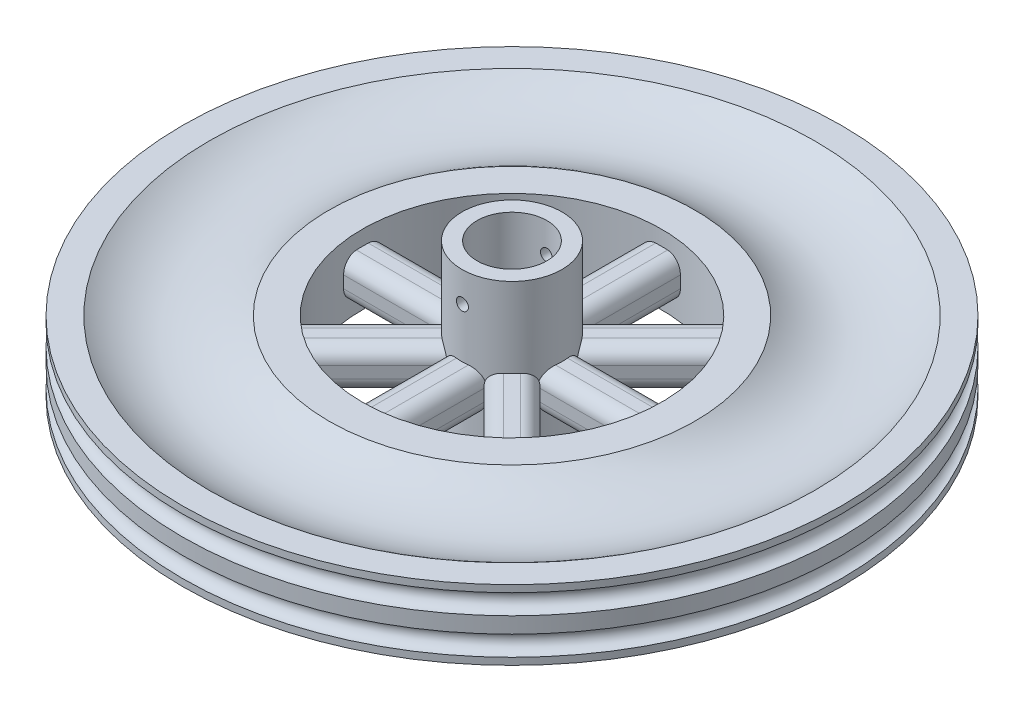
from build123d import *

# Parameters (mm, degrees)
SKETCH1_W                = 25
SKETCH1_H                = 100
BOSS_EXTRUDE1_REACH      = 240.642
BOSS_EXTRUDE1_END_RADIUS = 75
CIRPATTERN1_COUNT        = 8
SKETCH7_R                = 17.5
CUT_EXTRUDE1_DEPTH       = 92
SKETCH8_R                = 3
CUT_EXTRUDE2_DEPTH       = 25
FILLET1_R                = 2


with BuildPart() as part:
    # Sketch1 → Revolve1 (revolve)
    with BuildSketch(Plane.XY):
        with Locations((-12.5, 0)):
            Rectangle(SKETCH1_W, SKETCH1_H)
    revolve(axis=Axis((0, 170.759162304, 0), (0, -1, 0)))



with BuildPart() as body_2:
    # Sketch5 → Revolve2 (revolve)
    with BuildSketch(Plane.XY):
        with BuildLine():
            Line((-75, -17.5), (-75, 17.5))
            Line((-75, 17.5), (-91.608683351, 17.5))
            ThreePointArc((-91.608683351, 17.5), (-121.608683351, 7.5), (-151.608683351, 17.5))
            Line((-151.608683351, 17.5), (-165, 17.5))
            Line((-165, 17.5), (-165, 14))
            ThreePointArc((-165, 14), (-160, 9), (-165, 4))
            Line((-165, 4), (-165, -4))
            ThreePointArc((-165, -4), (-160, -9), (-165, -14))
            Line((-165, -14), (-165, -17.5))
            Line((-165, -17.5), (-151.608683351, -17.5))
            ThreePointArc((-151.608683351, -17.5), (-121.608683351, -7.5), (-91.608683351, -17.5))
            Line((-91.608683351, -17.5), (-75, -17.5))
        make_face()
    revolve(axis=Axis((0, 93.518433628, 0), (0, -1, 0)))


with BuildPart() as part_1:
    add(part.part)

    add(body_2.part)  # Boss-Extrude1 merges body 2
    # Boss-Extrude1: up to this cylinder (the profile starts inside it)
    boss_extrude1_end = Plane(origin=(0, 0, 0), z_dir=(0, 1, 0)) * Cylinder(BOSS_EXTRUDE1_END_RADIUS, 632.284, mode=Mode.PRIVATE)
    # Sketch6 → Boss-Extrude1 (add, up to the surface)
    with BuildSketch(Plane(origin=(0, 0, 0), x_dir=(0, 0, -1), z_dir=(1, 0, 0)), mode=Mode.PRIVATE) as boss_extrude1_sk1:
        with BuildLine():
            Line((3, 10), (-3, 10))
            ThreePointArc((-3, 10), (-7.949747468, 7.949747468), (-10, 3))
            Line((-10, 3), (-10, -3))
            ThreePointArc((-10, -3), (-7.949747468, -7.949747468), (-3, -10))
            Line((-3, -10), (3, -10))
            ThreePointArc((3, -10), (7.949747468, -7.949747468), (10, -3))
            Line((10, -3), (10, 3))
            ThreePointArc((10, 3), (7.949747468, 7.949747468), (3, 10))
        make_face()
    boss_extrude1_tool1 = extrude(boss_extrude1_sk1.sketch, amount=BOSS_EXTRUDE1_REACH, mode=Mode.PRIVATE) & boss_extrude1_end
    boss_extrude1 = boss_extrude1_tool1.solids().sort_by_distance((0, 0, 0))[0]
    add(boss_extrude1)

    # CirPattern1: Boss-Extrude1 ×8 about axis
    cirpattern1_axis = Axis((0, 0, 0), (0, 1, 0))
    for i in range(1, CIRPATTERN1_COUNT):
        add(boss_extrude1.rotate(cirpattern1_axis, i * 360 / CIRPATTERN1_COUNT))

    # Sketch7 → Cut-Extrude1 (cut)
    with BuildSketch(Plane(origin=(0, 50, 0), x_dir=(1, 0, 0), z_dir=(0, 1, 0))):
        Circle(SKETCH7_R)
    extrude(amount=-CUT_EXTRUDE1_DEPTH, mode=Mode.SUBTRACT)

    # Sketch8 → Cut-Extrude2 (cut, symmetric)
    with BuildSketch(Plane.XY):
        with Locations((0, 35)):
            Circle(SKETCH8_R)
    extrude(amount=CUT_EXTRUDE2_DEPTH, both=True, mode=Mode.SUBTRACT)

    # Fillet1
    fillet1_edges = [part_1.edges().sort_by_distance(p)[0] for p in [
        (25, -50, 0),
    ]]
    fillet(fillet1_edges, radius=FILLET1_R)


solid = part_1.part
